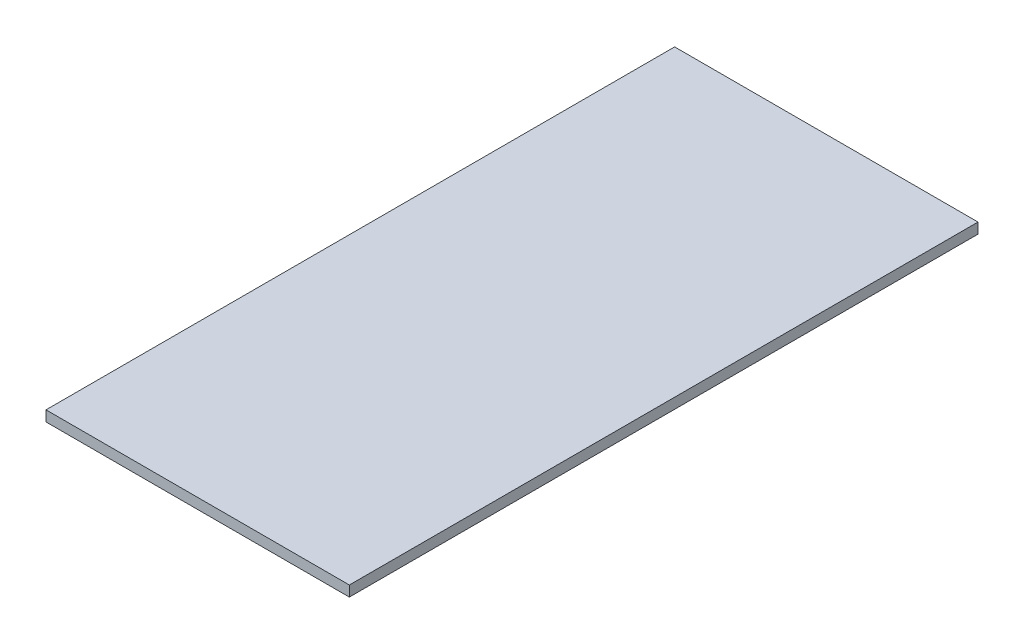
from build123d import *

# Parameters (mm, degrees)
SKETCH1_W           = 577.4
SKETCH1_H           = 20
BOSS_EXTRUDE1_DEPTH = 1196.5


with BuildPart() as part:
    # Sketch1 → Boss-Extrude1 (new body)
    with BuildSketch(Plane.XY):
        Rectangle(SKETCH1_W, SKETCH1_H)
    extrude(amount=BOSS_EXTRUDE1_DEPTH)


solid = part.part
